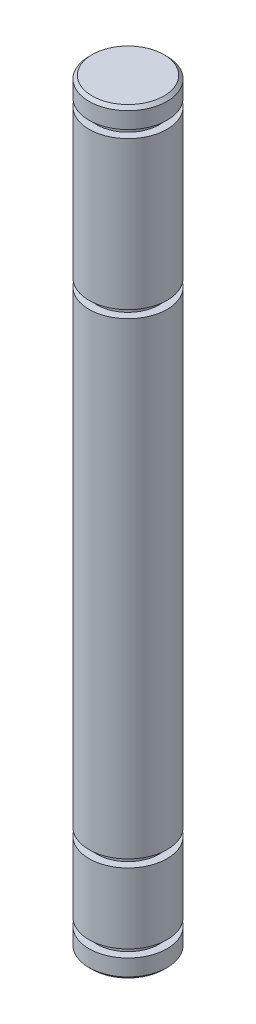
from build123d import *


with BuildPart() as part:
    # Sketch1 → Revolve1 (revolve)
    with BuildSketch(Plane.XY):
        Polygon((6.35, 61.087), (5.842, 61.595), (0, 61.595), (0, -61.595), (5.842, -61.595), (6.35, -61.087), (6.35, -58.42), (5.08, -58.42), (5.08, -57.15), (6.35, -57.15), (6.35, -45.72), (5.08, -45.72), (5.08, -44.45), (6.35, -44.45), (6.35, 31.75), (5.08, 31.75), (5.08, 33.02), (6.35, 33.02), (6.35, 57.15), (5.08, 57.15), (5.08, 58.42), (6.35, 58.42), align=None)
    revolve(axis=Axis((0, -61.595, 0), (0, 1, 0)))


solid = part.part
